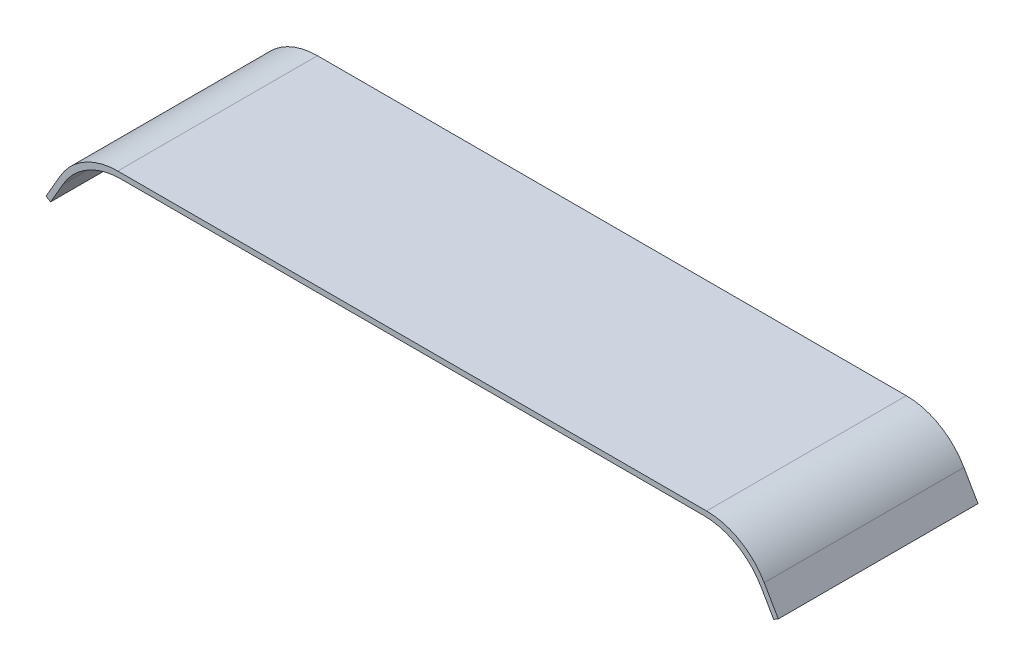
from build123d import *

# Parameters (mm, degrees)
BOSS_EXTRUDE1_DEPTH = 3
FILLET1_R           = 1


with BuildPart() as part:
    # Sketch1 → Boss-Extrude1 (new body)
    with BuildSketch(Plane.XY):
        Polygon((0, 0), (0.476905989, 0.826025404), (10.384529946, 0.826025404), (10.861435935, 0), (10.930717968, 0.04), (10.430717968, 0.906025404), (0.430717968, 0.906025404), (-0.069282032, 0.04), align=None)
    extrude(amount=BOSS_EXTRUDE1_DEPTH)

    # Fillet1
    fillet1_edges = [part.edges().sort_by_distance(p)[0] for p in [
        (0.430717968, 0.906025404, 1.5),
        (10.430717968, 0.906025404, 1.5),
        (10.384529946, 0.826025404, 1.5),
        (0.476905989, 0.826025404, 1.5),
    ]]
    fillet(fillet1_edges, radius=FILLET1_R)


solid = part.part
